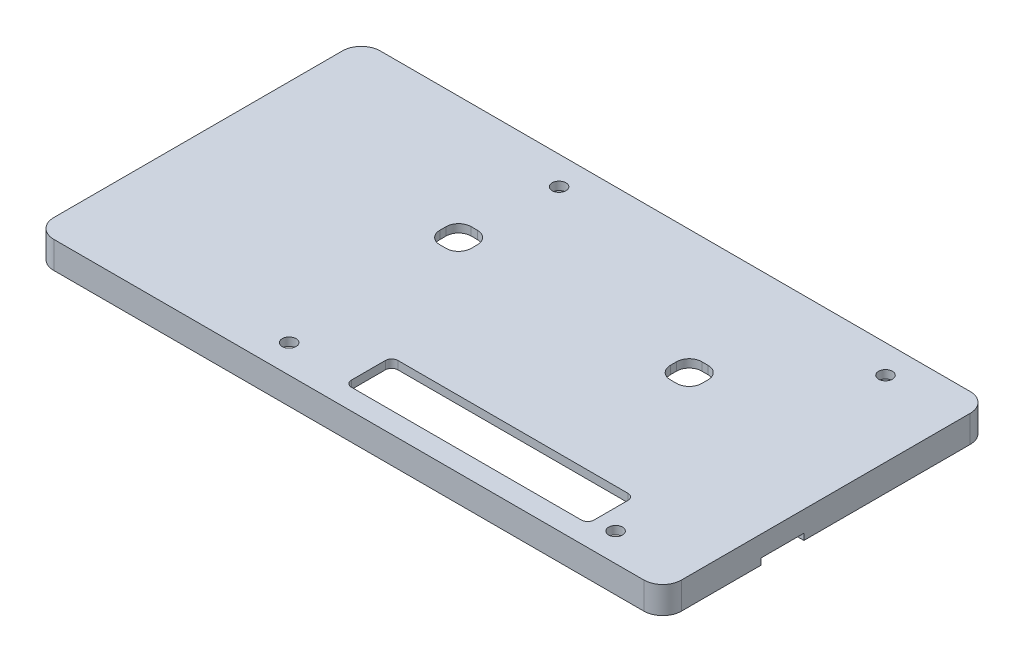
from build123d import *

# Parameters (mm, degrees)
SKETCH_1_W          = 100
SKETCH_1_H          = 52
EXTRUDE_1_DEPTH     = 8.6
SKETCH_2_W          = 97
SKETCH_2_H          = 49
CUT_EXTRUDE_1_DEPTH = 3
SKETCH_3_R          = 1.1
SKETCH_3_W          = 38.632034186
SKETCH_3_H          = 7.399361665
SKETCH_3_W_2        = 5
SKETCH_3_H_2        = 5
CUT_EXTRUDE_2_DEPTH = 61.603041755
FILLET_1_R          = 2
SKETCH_4_W          = 1.5
SKETCH_4_H          = 6.8
CUT_EXTRUDE_3_DEPTH = 1
SKETCH_5_W          = 97
SKETCH_5_H          = 49
CUT_EXTRUDE_4_DEPTH = 3
EXTRUDE_2_DEPTH     = 3
FILLET_2_R          = 3
FILLET_3_R          = 2
FILLET_5_R          = 1
SKETCH_9_W          = 52
SKETCH_9_H          = 4.3
CUT_EXTRUDE_5_DEPTH = 106.341399486


with BuildPart() as part:
    # 草图1 → 凸台-拉伸1 (new body)
    with BuildSketch(Plane(origin=(0, 0, 0), x_dir=(1, 0, 0), z_dir=(0, 1, 0))):
        with Locations((1.17145908, 5.982033169)):
            Rectangle(SKETCH_1_W, SKETCH_1_H)
    extrude(amount=EXTRUDE_1_DEPTH)

    # 草图2 → 切除-拉伸1 (cut)
    with BuildSketch(Plane.XZ):
        with Locations((1.17145908, -5.982033169)):
            Rectangle(SKETCH_2_W, SKETCH_2_H)
    extrude(amount=-CUT_EXTRUDE_1_DEPTH, mode=Mode.SUBTRACT)

    # 草图3 → 切除-拉伸2 (cut, through all)
    with BuildSketch(Plane.XZ.offset(-3)):
        with Locations(Location((-12.82854092, 15.517966831, 0), (0, 0, 270))):
            Circle(SKETCH_3_R)
        with Locations(Location((39.17145908, 15.517966831, 0), (0, 0, 270))):
            Circle(SKETCH_3_R)
        with Locations(Location((39.17145908, -27.482033169, 0), (0, 0, 270))):
            Circle(SKETCH_3_R)
        with Locations(Location((-12.82854092, -27.482033169, 0), (0, 0, 270))):
            Circle(SKETCH_3_R)
        with Locations((16.615396969, 13.018709543)):
            Rectangle(SKETCH_3_W, SKETCH_3_H)
        with Locations((-13.82854092, -12.482033169)):
            Rectangle(SKETCH_3_W_2, SKETCH_3_H_2)
        with Locations((23.17145908, -12.21289677)):
            Rectangle(SKETCH_3_W_2, SKETCH_3_H_2)
    extrude(amount=-CUT_EXTRUDE_2_DEPTH, mode=Mode.SUBTRACT)

    # 圆角1
    fillet_1_edges = [part.edges().sort_by_distance(p)[0] for p in [
        (20.67145908, 5.8, -14.71289677),
        (20.67145908, 5.8, -9.71289677),
        (25.67145908, 5.8, -9.71289677),
        (25.67145908, 5.8, -14.71289677),
        (-16.32854092, 5.8, -14.982033169),
        (-16.32854092, 5.8, -9.982033169),
        (-11.32854092, 5.8, -9.982033169),
        (-11.32854092, 5.8, -14.982033169),
    ]]
    fillet(fillet_1_edges, radius=FILLET_1_R)

    # 草图4 → 切除-拉伸3 (cut)
    with BuildSketch(Plane.XZ):
        with Locations((50.42145908, 0.917966831)):
            Rectangle(SKETCH_4_W, SKETCH_4_H)
    extrude(amount=-CUT_EXTRUDE_3_DEPTH, mode=Mode.SUBTRACT)

    # 草图5 → 切除-拉伸4 (cut)
    with BuildSketch(Plane(origin=(0, 8.6, 0), x_dir=(1, 0, 0), z_dir=(0, 1, 0))):
        with Locations((1.17145908, 5.982033169)):
            Rectangle(SKETCH_5_W, SKETCH_5_H)
    extrude(amount=-CUT_EXTRUDE_4_DEPTH, mode=Mode.SUBTRACT)

    # 草图7 → 凸台-拉伸2 (add, through all)
    with BuildSketch(Plane(origin=(0, 5.6, 0), x_dir=(1, 0, 0), z_dir=(0, 1, 0))):
        Polygon((-8.68854092, -18.517966831), (-8.68854092, 4.782033169), (-27.62854092, 4.782033169), (-27.62854092, 30.482033169), (-26.12854092, 30.482033169), (-26.12854092, 6.282033169), (-8.68854092, 6.282033169), (-8.68854092, 30.482033169), (-7.18854092, 30.482033169), (-7.18854092, -4.517966831), (49.67145908, -4.517966831), (49.67145908, -6.017966831), (-7.18854092, -6.017966831), (-7.18854092, -18.517966831), align=None)
        Polygon((16.97145908, 30.482033169), (16.97145908, 6.682033169), (30.17145908, 6.682033169), (30.17145908, 30.482033169), (28.67145908, 30.482033169), (28.67145908, 8.182033169), (18.47145908, 8.182033169), (18.47145908, 30.482033169), align=None)
    extrude(amount=EXTRUDE_2_DEPTH)

    # 圆角2
    fillet_2_edges = [part.edges().sort_by_distance(p)[0] for p in [
        (-48.82854092, 4.3, -31.982033169),
        (51.17145908, 4.3, -31.982033169),
        (51.17145908, 4.3, 20.017966831),
        (-48.82854092, 4.3, 20.017966831),
    ]]
    fillet(fillet_2_edges, radius=FILLET_2_R)

    # 圆角3
    fillet_3_edges = [part.edges().sort_by_distance(p)[0] for p in [
        (49.67145908, 1.5, 18.517966831),
        (49.67145908, 1.5, -30.482033169),
        (-47.32854092, 1.5, -30.482033169),
        (-47.32854092, 1.5, 18.517966831),
        (-47.32854092, 7.1, 18.517966831),
        (-47.32854092, 7.1, -30.482033169),
        (49.67145908, 7.1, -30.482033169),
        (49.67145908, 7.1, 18.517966831),
        (-8.68854092, 7.1, 18.517966831),
        (-7.18854092, 7.1, 18.517966831),
        (-7.18854092, 7.1, 6.017966831),
        (49.67145908, 7.1, 6.017966831),
        (49.67145908, 7.1, 4.517966831),
        (-7.18854092, 7.1, 4.517966831),
        (-7.18854092, 7.1, -30.482033169),
        (-8.68854092, 7.1, -30.482033169),
        (-8.68854092, 7.1, -6.282033169),
        (-26.12854092, 7.1, -6.282033169),
        (-26.12854092, 7.1, -30.482033169),
        (-27.62854092, 7.1, -30.482033169),
        (-27.62854092, 7.1, -4.782033169),
        (-8.68854092, 7.1, -4.782033169),
        (18.47145908, 7.1, -30.482033169),
        (16.97145908, 7.1, -30.482033169),
        (16.97145908, 7.1, -6.682033169),
        (30.17145908, 7.1, -6.682033169),
        (30.17145908, 7.1, -30.482033169),
        (28.67145908, 7.1, -30.482033169),
        (28.67145908, 7.1, -8.182033169),
        (18.47145908, 7.1, -8.182033169),
    ]]
    fillet(fillet_3_edges, radius=FILLET_3_R)

    # 圆角5
    fillet_5_edges = [part.edges().sort_by_distance(p)[0] for p in [
        (-2.700620124, 4.3, 16.718390375),
        (35.931414062, 4.3, 16.718390375),
        (-2.700620124, 4.3, 9.31902871),
        (35.931414062, 4.3, 9.31902871),
    ]]
    fillet(fillet_5_edges, radius=FILLET_5_R)

    # 草图9 → 切除-拉伸5 (cut, through all)
    with BuildSketch(Plane(origin=(51.17145908, 0, 0), x_dir=(0, 0, -1), z_dir=(1, 0, 0))):
        with Locations((5.982033169, 6.45)):
            Rectangle(SKETCH_9_W, SKETCH_9_H)
    extrude(amount=-CUT_EXTRUDE_5_DEPTH, mode=Mode.SUBTRACT)


solid = part.part
